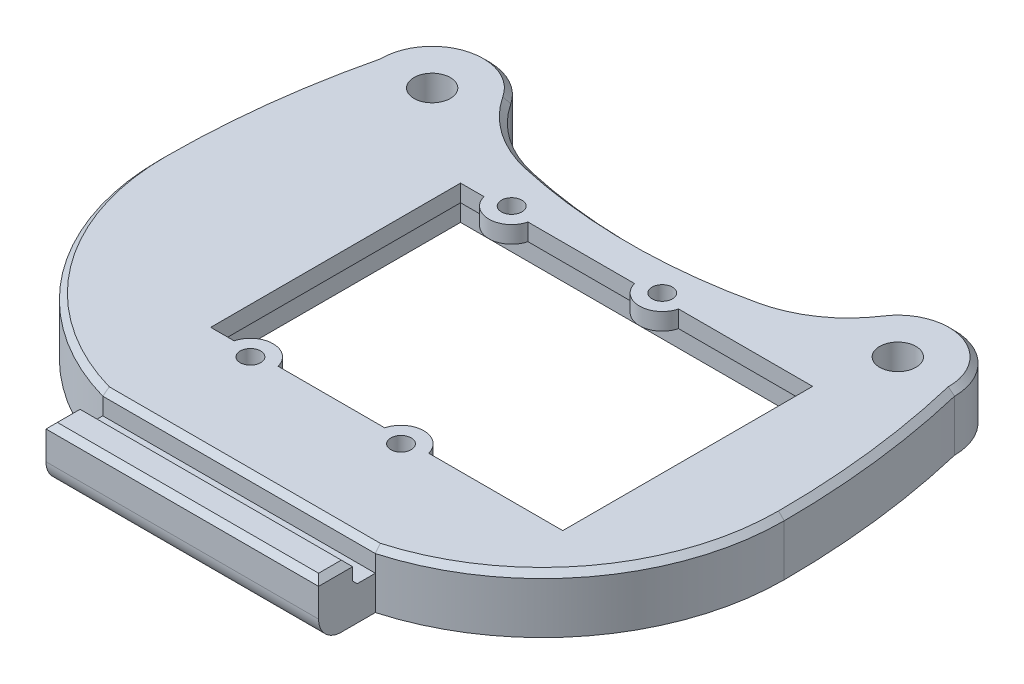
from build123d import *

# Parameters (mm, degrees)
COMPLETE_SKETCH_R                   = 1.6
BODY_DEPTH                          = 5
SMOOTHING_FILLET_R                  = 10
CUT_EXTRUDE1_START                  = -5
SKETCH1_R                           = 0.9
CUT_EXTRUDE1_DEPTH                  = 5
CUT_EXTRUDE2_START                  = -5
SKETCH1_4_W                         = 35
SKETCH1_4_H                         = 26
CUT_EXTRUDE2_DEPTH                  = 3.5
BOSS_EXTRUDE1_DEPTH                 = 24
ELEPHANTSFOOT_COMPENSATION_TOP_SIZE = 0.5
CHAMFER1_SIZE                       = 0.4


with BuildPart() as part:
    # complete_sketch → body (new body)
    with BuildSketch(Plane(origin=(0, 0, 0), x_dir=(1, 0, 0), z_dir=(0, 1, 0))):
        with BuildLine():
            Line((0, -20.5), (24, -20.5))
            ThreePointArc((24, -20.5), (35.188838333, -12.850097276), (39.5, 0))
            ThreePointArc((39.5, 0), (38.998281767, 8.558621384), (37.5, 17))
            ThreePointArc((37.5, 17), (32.5, 22), (27.5, 17))
            ThreePointArc((27.5, 17), (12, 14.321592614), (-3.5, 17))
            ThreePointArc((-3.5, 17), (-8.5, 22), (-13.5, 17))
            ThreePointArc((-13.5, 17), (-14.998281767, 8.558621384), (-15.5, 0))
            ThreePointArc((-15.5, 0), (-11.188838333, -12.850097276), (0, -20.5))
        make_face()
        with Locations(Location((24, 0, 0), (0, 0, 270))):
            Circle(COMPLETE_SKETCH_R, mode=Mode.SUBTRACT)
        with Locations(Location((-8.5, 17, 0), (0, 0, 270))):
            Circle(COMPLETE_SKETCH_R, mode=Mode.SUBTRACT)
        with Locations(Location((32.5, 17, 0), (0, 0, 270))):
            Circle(COMPLETE_SKETCH_R, mode=Mode.SUBTRACT)
    extrude(amount=BODY_DEPTH)

    # smoothing_fillet
    smoothing_fillet_edges = [part.edges().sort_by_distance(p)[0] for p in [
        (-3.5, 2.5, -17),
        (27.5, 2.5, -17),
    ]]
    fillet(smoothing_fillet_edges, radius=SMOOTHING_FILLET_R)

    # Sketch1 → Cut-Extrude1 (cut)
    with BuildSketch(Plane(origin=(0, 5, 0), x_dir=(1, 0, 0), z_dir=(0, 1, 0)).offset(CUT_EXTRUDE1_START)):
        with BuildLine():
            Line((31, -11), (31, 11))
            Line((31, 11), (19.196491673, 11))
            ThreePointArc((19.196491673, 11), (17.26, 9.5), (15.323508327, 11))
            Line((15.323508327, 11), (5.936491673, 11))
            ThreePointArc((5.936491673, 11), (4, 9.5), (2.063508327, 11))
            Line((2.063508327, 11), (0, 11))
            Line((0, 11), (0, -11))
            Line((0, -11), (2.063508327, -11))
            ThreePointArc((2.063508327, -11), (4, -9.5), (5.936491673, -11))
            Line((5.936491673, -11), (15.323508327, -11))
            ThreePointArc((15.323508327, -11), (17.26, -9.5), (19.196491673, -11))
            Line((19.196491673, -11), (31, -11))
        make_face()
        with Locations(Location((4, 11.5, 0), (0, 0, 270))):
            Circle(SKETCH1_R)
        with Locations(Location((17.26, 11.5, 0), (0, 0, 270))):
            Circle(SKETCH1_R)
        with Locations(Location((17.26, -11.5, 0), (0, 0, 270))):
            Circle(SKETCH1_R)
        with Locations(Location((4, -11.5, 0), (0, 0, 270))):
            Circle(SKETCH1_R)
    extrude(amount=CUT_EXTRUDE1_DEPTH, mode=Mode.SUBTRACT)

    # Sketch1<4> → Cut-Extrude2 (cut)
    with BuildSketch(Plane(origin=(0, 5, 0), x_dir=(1, 0, 0), z_dir=(0, 1, 0)).offset(CUT_EXTRUDE2_START)):
        with Locations((15.5, 0)):
            Rectangle(SKETCH1_4_W, SKETCH1_4_H)
    extrude(amount=CUT_EXTRUDE2_DEPTH, mode=Mode.SUBTRACT)

    # Sketch2 → Boss-Extrude1 (add)
    with BuildSketch(Plane(origin=(0, 0, 0), x_dir=(0, 0, -1), z_dir=(1, 0, 0))):
        with BuildLine():
            Line((-20.5, 0), (-23.5, 0))
            ThreePointArc((-23.5, 0), (-24.914213562, 0.585786438), (-25.5, 2))
            Line((-25.5, 2), (-25.5, 5))
            Line((-25.5, 5), (-22.5, 5))
            Line((-22.5, 5), (-22.5, 3))
            Line((-22.5, 3), (-20.5, 3))
            Line((-20.5, 3), (-20.5, 0))
        make_face()
    extrude(amount=BOSS_EXTRUDE1_DEPTH)

    # elephantsfoot_compensation top
    elephantsfoot_compensation_top_edges = [part.edges().sort_by_distance(p)[0] for p in [
        (33.926618039, 5, -21.792156192),
        (25.643793964, 5, -16.988490587),
        (38.998281767, 5, -8.558621384),
        (12, 5, -14.321592614),
        (35.188838333, 5, 12.850097276),
        (-1.643793964, 5, -16.988490587),
        (12, 5, 20.5),
        (-9.926618039, 5, -21.792156192),
        (-11.188838333, 5, 12.850097276),
        (-14.998281767, 5, -8.558621384),
        (24, 5, 24),
        (0, 5, 24),
        (12, 5, 25.5),
        (12, 5, 22.5),
    ]]
    chamfer(elephantsfoot_compensation_top_edges, length=ELEPHANTSFOOT_COMPENSATION_TOP_SIZE)

    # Chamfer1
    chamfer1_edges = [part.edges().sort_by_distance(p)[0] for p in [
        (12, 3, 22.5),
    ]]
    chamfer(chamfer1_edges, length=CHAMFER1_SIZE)


solid = part.part
